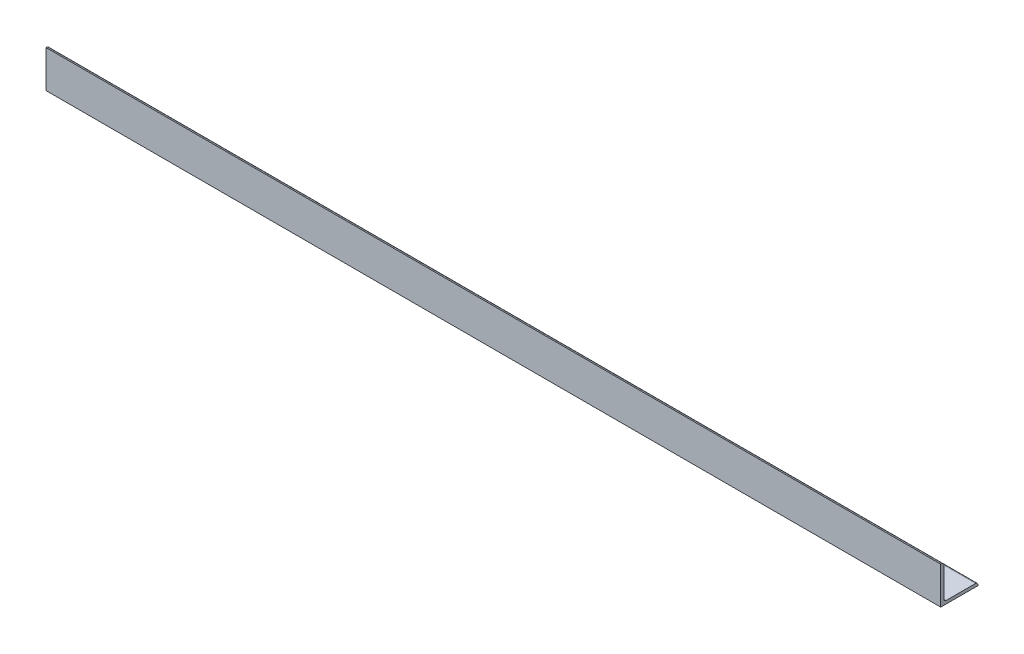
from build123d import *

# Parameters (mm, degrees)
BOSS_EXTRUDE1_DEPTH      = 914.4
BOSS_EXTRUDE1_DEPTH_BACK = 914.4


with BuildPart() as part:
    # Sketch1 → Boss-Extrude1 (new, two sides: drawn at the far end of the back side and taken through both)
    with BuildSketch(Plane(origin=(0, 0, 0), x_dir=(0, 0, -1), z_dir=(1, 0, 0)).offset(-BOSS_EXTRUDE1_DEPTH_BACK)):
        with BuildLine():
            Line((0, 76.2), (0, 0))
            Line((0, 0), (76.2, 0))
            Line((76.2, 0), (76.2, 1.27))
            ThreePointArc((76.2, 1.27), (74.712102448, 4.862102448), (71.12, 6.35))
            Line((71.12, 6.35), (11.43, 6.35))
            ThreePointArc((11.43, 6.35), (7.837897552, 7.837897552), (6.35, 11.43))
            Line((6.35, 11.43), (6.35, 71.12))
            ThreePointArc((6.35, 71.12), (4.862102448, 74.712102448), (1.27, 76.2))
            Line((1.27, 76.2), (0, 76.2))
        make_face()
    extrude(amount=BOSS_EXTRUDE1_DEPTH + BOSS_EXTRUDE1_DEPTH_BACK)


solid = part.part
